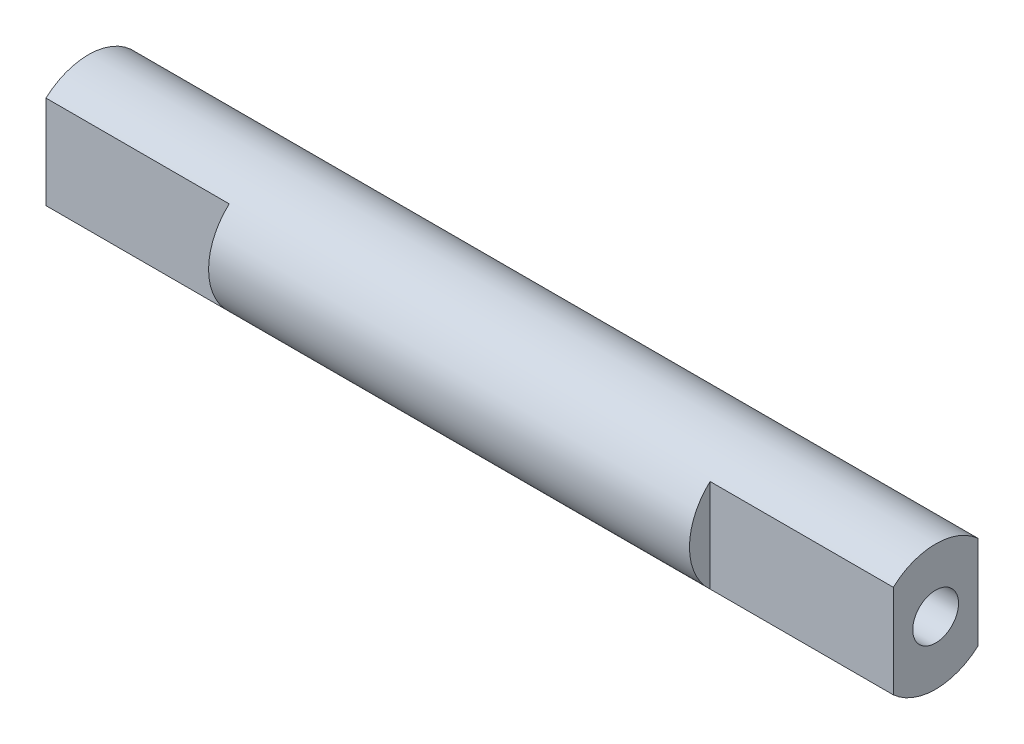
from build123d import *

# Parameters (mm, degrees)
SKETCH1_R           = 2.75
BOSS_EXTRUDE1_DEPTH = 18.5
CUT_EXTRUDE1_DEPTH  = 8
SKETCH3_R           = 1
CUT_EXTRUDE2_DEPTH  = 6


with BuildPart() as part:
    # Sketch1 → Boss-Extrude1 (new, symmetric)
    with BuildSketch(Plane(origin=(0, 0, 0), x_dir=(0, 0, -1), z_dir=(1, 0, 0))):
        Circle(SKETCH1_R)
    extrude(amount=BOSS_EXTRUDE1_DEPTH, both=True)

    # Sketch2 → Cut-Extrude1 (cut)
    with BuildSketch(Plane(origin=(18.5, 0, 0), x_dir=(0, 0, -1), z_dir=(1, 0, 0))):
        with BuildLine():
            Line((-1.85, 2.034698995), (-1.85, -2.034698995))
            ThreePointArc((-1.85, -2.034698995), (-2.75, 0), (-1.85, 2.034698995))
        make_face()
        with BuildLine():
            Line((1.85, 2.034698995), (1.85, -2.034698995))
            ThreePointArc((1.85, -2.034698995), (2.75, 0), (1.85, 2.034698995))
        make_face()
    cut_extrude1 = extrude(amount=-CUT_EXTRUDE1_DEPTH, mode=Mode.SUBTRACT)

    # Sketch3 → Cut-Extrude2 (cut)
    with BuildSketch(Plane(origin=(18.5, 0, 0), x_dir=(0, 0, -1), z_dir=(1, 0, 0))):
        Circle(SKETCH3_R)
    cut_extrude2 = extrude(amount=-CUT_EXTRUDE2_DEPTH, mode=Mode.SUBTRACT)

    # Mirror1: Cut-Extrude1, Cut-Extrude2 across plane
    add(cut_extrude1.mirror(Plane(origin=(0, 0, 0), x_dir=(0, 0, 1), z_dir=(1, 0, 0))), mode=Mode.SUBTRACT)
    add(cut_extrude2.mirror(Plane(origin=(0, 0, 0), x_dir=(0, 0, 1), z_dir=(1, 0, 0))), mode=Mode.SUBTRACT)


solid = part.part
